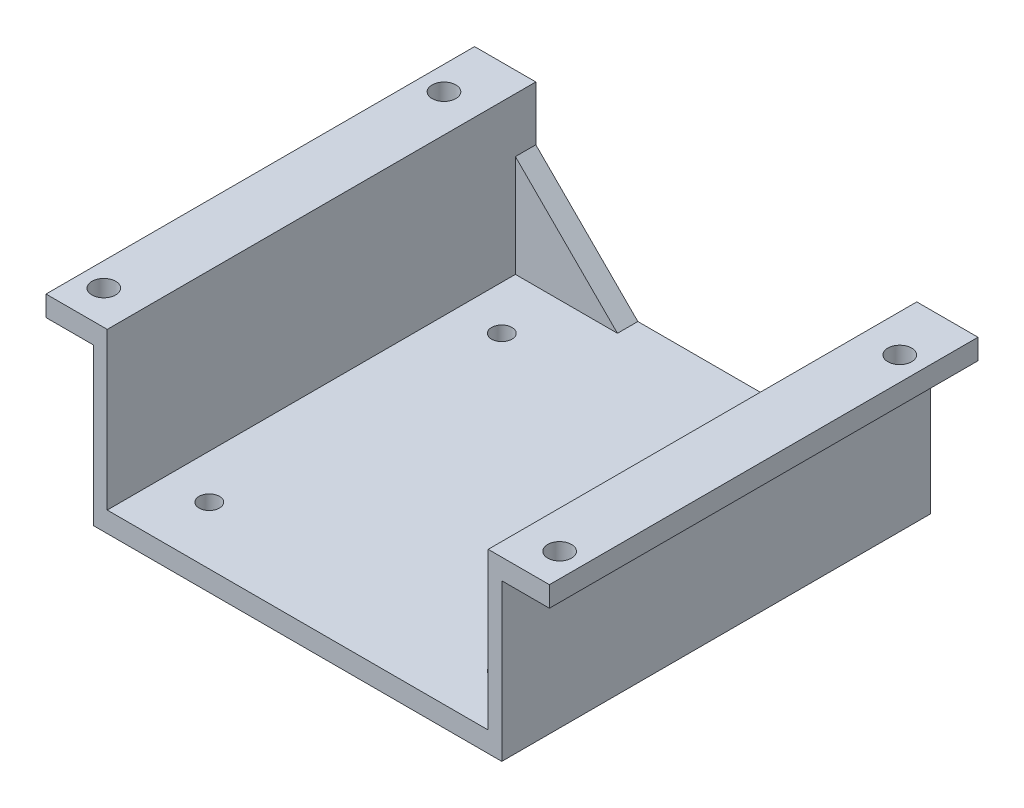
from build123d import *

# Parameters (mm, degrees)
SKETCH_1_W      = 60
SKETCH_1_H      = 60
EXTRUDE_1_DEPTH = 3
HOLE_WIZARD_1_D = 3
SKETCH_5_W      = 2
SKETCH_5_H      = 60
EXTRUDE_2_DEPTH = 23
SKETCH_6_W      = 60
SKETCH_6_H      = 3
EXTRUDE_3_DEPTH = 7
HOLE_WIZARD_2_D = 3.5
EXTRUDE_4_DEPTH = 3
EXTRUDE_5_DEPTH = 3


with BuildPart() as part:
    # 草图1 → 凸台-拉伸1 (new body)
    with BuildSketch(Plane(origin=(0, 0, 0), x_dir=(1, 0, 0), z_dir=(0, 1, 0))):
        Rectangle(SKETCH_1_W, SKETCH_1_H)
    extrude(amount=EXTRUDE_1_DEPTH)

    # 孔1 (through all)
    with Locations(Plane(origin=(0, 3, 0), x_dir=(1, 0, 0), z_dir=(0, 1, 0))):
        with Locations((-21.5, 21.5), (21.5, 21.5), (-21.5, -21.5), (21.5, -21.5)):
            Hole(HOLE_WIZARD_1_D / 2)

    # 草图5 → 凸台-拉伸2 (add)
    with BuildSketch(Plane(origin=(0, 3, 0), x_dir=(1, 0, 0), z_dir=(0, 1, 0))):
        with Locations((29, 0)):
            Rectangle(SKETCH_5_W, SKETCH_5_H)
        with Locations((-29, 0)):
            Rectangle(SKETCH_5_W, SKETCH_5_H)
    extrude(amount=EXTRUDE_2_DEPTH)

    # 草图6 → 凸台-拉伸3 (add)
    with BuildSketch(Plane(origin=(30, 0, 0), x_dir=(0, 0, -1), z_dir=(1, 0, 0))):
        with Locations((0, 24.5)):
            Rectangle(SKETCH_6_W, SKETCH_6_H)
    extrude_3 = extrude(amount=EXTRUDE_3_DEPTH)

    # 孔2 (through all)
    with Locations(Plane(origin=(0, 26, 0), x_dir=(1, 0, 0), z_dir=(0, 1, 0))):
        with Locations((33.5, 25), (33.5, -25)):
            hole_wizard_2 = Hole(HOLE_WIZARD_2_D / 2)

    # 镜向1: 凸台-拉伸3, 孔2 across plane
    add(extrude_3.mirror(Plane.ZY))
    add(hole_wizard_2.mirror(Plane.ZY), mode=Mode.SUBTRACT)

    # 草图11 → 凸台-拉伸4 (add)
    with BuildSketch(Plane(origin=(0, 0, -30), x_dir=(-1, 0, 0), z_dir=(0, 0, -1))):
        Polygon((-37, 26), (-28, 26), (-28, 3), (28, 3), (28, 26), (37, 26), (37, 23), (30, 23), (30, 0), (-30, 0), (-30, 23), (-37, 23), align=None)
    extrude(amount=EXTRUDE_4_DEPTH)

    # 草图12 → 凸台-拉伸5 (add)
    with BuildSketch(Plane(origin=(0, 0, -33), x_dir=(-1, 0, 0), z_dir=(0, 0, -1))):
        Polygon((-28, 18), (-13, 3), (-28, 3), align=None)
        Polygon((28, 18), (13, 3), (28, 3), align=None)
    extrude(amount=-EXTRUDE_5_DEPTH)


solid = part.part
